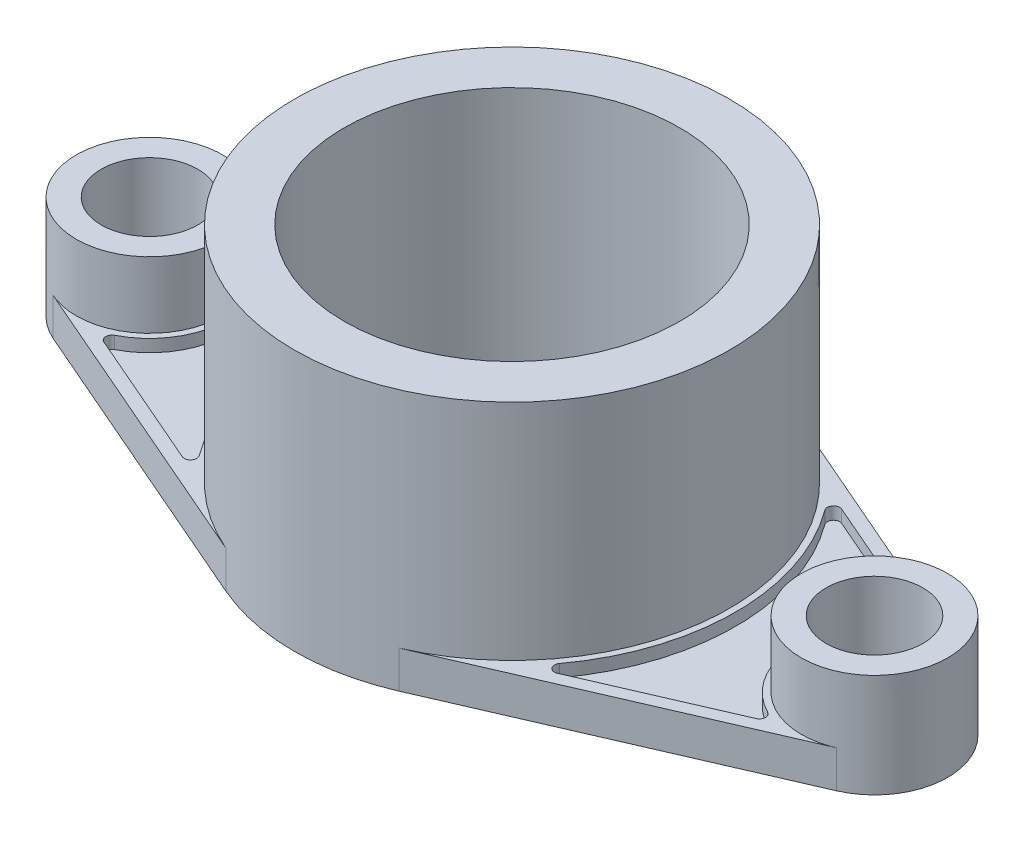
from build123d import *

# Parameters (mm, degrees)
SKETCH1_R             = 52.5
SKETCH1_R_2           = 40.5
BOSS_EXTRUDE1_DEPTH   = 63
SKETCH2_R             = 17.665
SKETCH2_R_2           = 11.665
BOSS_EXTRUDE2_DEPTH   = 25
BOSS_EXTRUDE2_2_DEPTH = 25
BOSS_EXTRUDE3_DEPTH   = 9
CUT_EXTRUDE1_DEPTH    = 57


with BuildPart() as part:
    # Sketch1 → Boss-Extrude1 (new body)
    with BuildSketch(Plane(origin=(0, 0, 0), x_dir=(1, 0, 0), z_dir=(0, 1, 0))):
        with Locations(Location((0, 0, 0), (0, 0, 270))):
            Circle(SKETCH1_R)
        with Locations(Location((0, 0, 0), (0, 0, 270))):
            Circle(SKETCH1_R_2, mode=Mode.SUBTRACT)
    extrude(amount=BOSS_EXTRUDE1_DEPTH)



with BuildPart() as body_2:
    # Sketch2 → Boss-Extrude2 (new body)
    with BuildSketch(Plane(origin=(0, 25, 0), x_dir=(1, 0, 0), z_dir=(0, 1, 0))):
        with Locations(Location((87.5, 0, 0), (0, 0, 270))):
            Circle(SKETCH2_R)
        with Locations(Location((87.5, 0, 0), (0, 0, 270))):
            Circle(SKETCH2_R_2, mode=Mode.SUBTRACT)
    extrude(amount=-BOSS_EXTRUDE2_DEPTH)


with BuildPart() as body_3:
    # Sketch2 → Boss-Extrude2 2 (new body)
    with BuildSketch(Plane(origin=(0, 25, 0), x_dir=(1, 0, 0), z_dir=(0, 1, 0))):
        with Locations(Location((-87.5, 0, 0), (0, 0, 270))):
            Circle(SKETCH2_R)
        with Locations(Location((-87.5, 0, 0), (0, 0, 270))):
            Circle(SKETCH2_R_2, mode=Mode.SUBTRACT)
    extrude(amount=-BOSS_EXTRUDE2_2_DEPTH)


with BuildPart() as part_1:
    add(part.part)

    add(body_2.part)  # Boss-Extrude3 merges body 2

    add(body_3.part)  # Boss-Extrude3 merges body 3
    # Sketch3 → Boss-Extrude3 (add)
    with BuildSketch(Plane(origin=(0, 0, 0), x_dir=(-1, 0, 0), z_dir=(0, -1, 0))):
        with BuildLine():
            Line((-94.532688857, 16.204737346), (-20.901, 48.160130803))
            ThreePointArc((-20.901, 48.160130803), (-52.5, 0), (-20.901, -48.160130803))
            Line((-20.901, -48.160130803), (-94.532688857, -16.204737346))
            ThreePointArc((-94.532688857, -16.204737346), (-69.835, 0), (-94.532688857, 16.204737346))
        make_face()
        with BuildLine():
            Line((20.901, 48.160130803), (94.532688857, 16.204737346))
            ThreePointArc((94.532688857, 16.204737346), (69.835, 0), (94.532688857, -16.204737346))
            Line((94.532688857, -16.204737346), (20.901, -48.160130803))
            ThreePointArc((20.901, -48.160130803), (52.5, 0), (20.901, 48.160130803))
        make_face()
    extrude(amount=-BOSS_EXTRUDE3_DEPTH)

    # Sketch4 → Cut-Extrude1 (cut)
    with BuildSketch(Plane(origin=(0, 63, 0), x_dir=(1, 0, 0), z_dir=(0, 1, 0))):
        with BuildLine():
            Line((-78.726335185, 19.794191843), (-45.264792214, 34.316156339))
            ThreePointArc((-45.264792214, 34.316156339), (-43.494143933, 33.874471647), (-43.460387791, 32.049878207))
            ThreePointArc((-43.460387791, 32.049878207), (-54, 0), (-43.460387791, -32.049878207))
            ThreePointArc((-43.460387791, -32.049878207), (-43.494143933, -33.874471647), (-45.264792214, -34.316156339))
            Line((-45.264792214, -34.316156339), (-78.726335185, -19.794191843))
            ThreePointArc((-78.726335185, -19.794191843), (-79.628461818, -18.464071905), (-78.809359951, -17.081276315))
            ThreePointArc((-78.809359951, -17.081276315), (-68.335, 0), (-78.809359951, 17.081276315))
            ThreePointArc((-78.809359951, 17.081276315), (-79.628461818, 18.464071905), (-78.726335185, 19.794191843))
        make_face()
        with BuildLine():
            Line((78.726335185, -19.794191843), (45.264792214, -34.316156339))
            ThreePointArc((45.264792214, -34.316156339), (43.494143933, -33.874471647), (43.460387791, -32.049878207))
            ThreePointArc((43.460387791, -32.049878207), (54, 0), (43.460387791, 32.049878207))
            ThreePointArc((43.460387791, 32.049878207), (43.494143933, 33.874471647), (45.264792214, 34.316156339))
            Line((45.264792214, 34.316156339), (78.726335185, 19.794191843))
            ThreePointArc((78.726335185, 19.794191843), (79.628461818, 18.464071905), (78.809359951, 17.081276315))
            ThreePointArc((78.809359951, 17.081276315), (68.335, 0), (78.809359951, -17.081276315))
            ThreePointArc((78.809359951, -17.081276315), (79.628461818, -18.464071905), (78.726335185, -19.794191843))
        make_face()
    extrude(amount=-CUT_EXTRUDE1_DEPTH, mode=Mode.SUBTRACT)


solid = part_1.part
